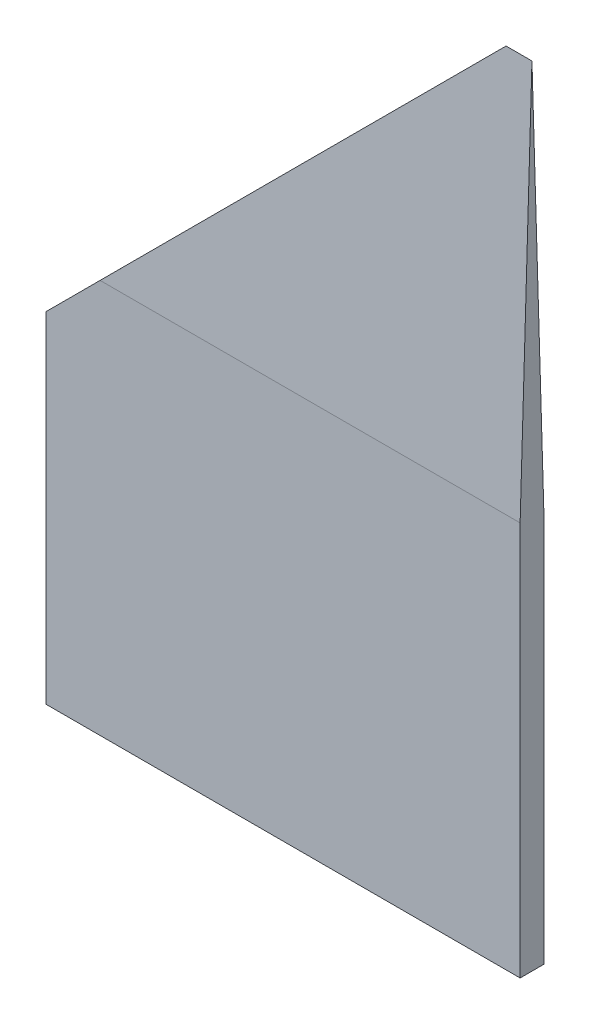
from build123d import *

# Parameters (mm, degrees)
BOSS_EXTRUDE2_DEPTH = 1.27
CUT_EXTRUDE1_DEPTH  = 100.076


with BuildPart() as part:
    # Sketch2 → Boss-Extrude2 (new, symmetric)
    with BuildSketch(Plane.XY):
        Polygon((-30.279813291, 84.630063366), (-78.379813291, 36.530063366), (-78.379813291, 0), (-27.5, 0), (-27.5, 84.630063366), align=None)
    extrude(amount=BOSS_EXTRUDE2_DEPTH, both=True)

    # Sketch3 → Cut-Extrude1 (cut)
    with BuildSketch(Plane(origin=(0, 0, 0), x_dir=(0, 0, -1), z_dir=(1, 0, 0))):
        Polygon((0, 84.630063366), (-1.27, 42.315031683), (-13.710908903, 42.315031683), (-13.710908903, 86.832104907), (21.305265315, 86.832104907), (21.305265315, 42.315031683), (1.27, 42.315031683), align=None)
    extrude(amount=-CUT_EXTRUDE1_DEPTH, mode=Mode.SUBTRACT)


solid = part.part
